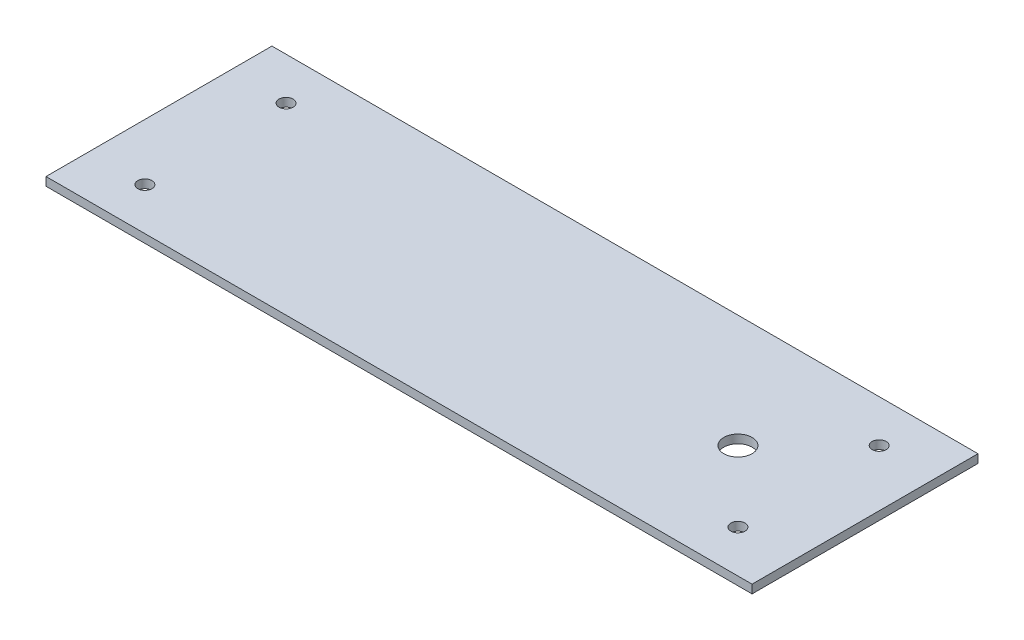
from build123d import *

# Parameters (mm, degrees)
SKETCH1_W           = 250
SKETCH1_H           = 80
SKETCH1_R           = 2.5
SKETCH1_R_2         = 5
BOSS_EXTRUDE1_DEPTH = 3


with BuildPart() as part:
    # Sketch1 → Boss-Extrude1 (new body)
    with BuildSketch(Plane(origin=(0, 0, 0), x_dir=(1, 0, 0), z_dir=(0, 1, 0))):
        with Locations((18.521650391, 12.074546046)):
            Rectangle(SKETCH1_W, SKETCH1_H)
        with Locations(Location((-86.478349609, 37.074546046, 0), (0, 0, 270))):
            Circle(SKETCH1_R, mode=Mode.SUBTRACT)
        with Locations(Location((-86.478349609, -12.925453954, 0), (0, 0, 270))):
            Circle(SKETCH1_R, mode=Mode.SUBTRACT)
        with Locations(Location((123.521650391, 37.074546046, 0), (0, 0, 270))):
            Circle(SKETCH1_R, mode=Mode.SUBTRACT)
        with Locations(Location((123.521650391, -12.925453954, 0), (0, 0, 270))):
            Circle(SKETCH1_R, mode=Mode.SUBTRACT)
        with Locations(Location((98.521650391, 12.074546046, 0), (0, 0, 270))):
            Circle(SKETCH1_R_2, mode=Mode.SUBTRACT)
    extrude(amount=BOSS_EXTRUDE1_DEPTH)


solid = part.part
